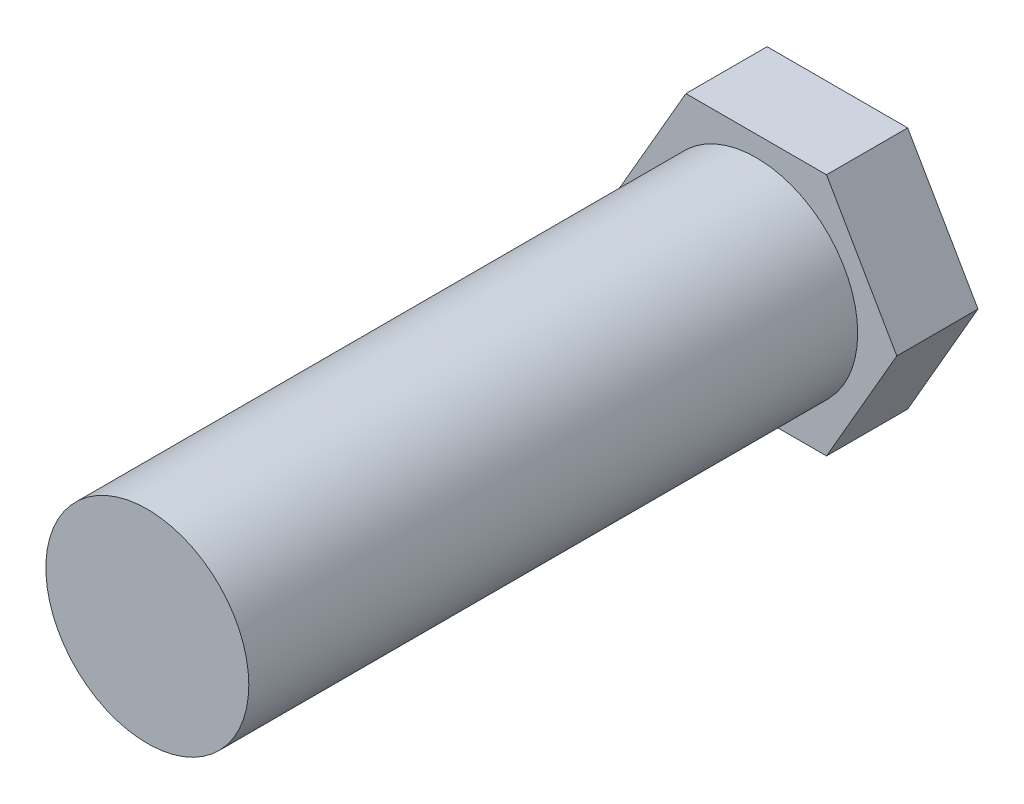
from build123d import *

# Parameters (mm, degrees)
BOSS_EXTRUDE1_DEPTH = 0.2
SKETCH2_R           = 0.25
BOSS_EXTRUDE2_DEPTH = 1.5


with BuildPart() as part:
    # Sketch1 → Boss-Extrude1 (new body)
    with BuildSketch(Plane.XY):
        Polygon((0.173205081, 0.3), (-0.173205081, 0.3), (-0.346410162, 0), (-0.173205081, -0.3), (0.173205081, -0.3), (0.346410162, 0), align=None)
    extrude(amount=BOSS_EXTRUDE1_DEPTH)

    # Sketch2 → Boss-Extrude2 (add)
    with BuildSketch(Plane.XY.offset(0.2)):
        Circle(SKETCH2_R)
    extrude(amount=BOSS_EXTRUDE2_DEPTH)


solid = part.part
